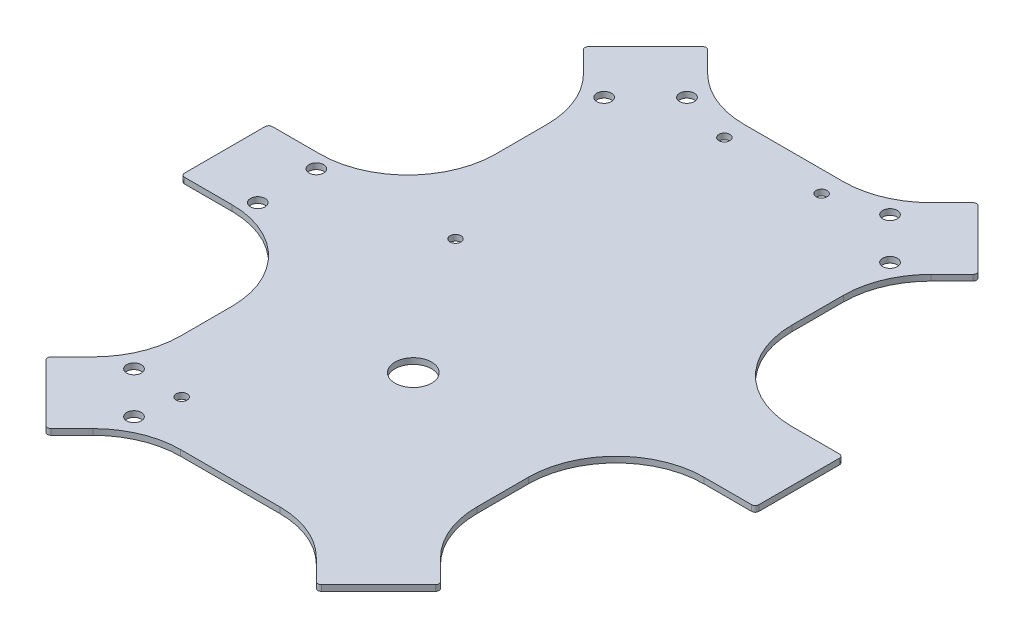
from build123d import *

# Parameters (mm, degrees)
SKETCH_8_R      = 2
SKETCH_8_R_2    = 5
SKETCH_8_R_3    = 1.5
EXTRUDE_1_DEPTH = 1.6


with BuildPart() as part:
    # 草图8 → 凸台-拉伸1 (new body)
    with BuildSketch(Plane.XZ):
        with BuildLine():
            Line((30.529437252, 84), (36.227922061, 89.69848481))
            ThreePointArc((36.227922061, 89.69848481), (36.935028843, 89.991378029), (37.642135624, 89.69848481))
            Line((37.642135624, 89.69848481), (53.19848481, 74.142135624))
            ThreePointArc((53.19848481, 74.142135624), (53.491378029, 73.435028843), (53.19848481, 72.727922061))
            Line((53.19848481, 72.727922061), (47.5, 67.029437252))
            ThreePointArc((47.5, 67.029437252), (42.297453968, 59.24327688), (40.470562748, 50.058874503))
            Line((40.470562748, 50.058874503), (40.470562748, 36))
            ThreePointArc((40.470562748, 36), (47.5, 19.029437252), (64.470562748, 12))
            Line((64.470562748, 12), (77.470562748, 12))
            ThreePointArc((77.470562748, 12), (78.17766953, 11.707106781), (78.470562748, 11))
            Line((78.470562748, 11), (78.470562748, -11))
            ThreePointArc((78.470562748, -11), (78.17766953, -11.707106781), (77.470562748, -12))
            Line((77.470562748, -12), (64.470562748, -12))
            ThreePointArc((64.470562748, -12), (47.5, -19.029437252), (40.470562748, -36))
            Line((40.470562748, -36), (40.470562748, -50.058874503))
            ThreePointArc((40.470562748, -50.058874503), (42.297453968, -59.24327688), (47.5, -67.029437252))
            Line((47.5, -67.029437252), (53.19848481, -72.727922061))
            ThreePointArc((53.19848481, -72.727922061), (53.491378029, -73.435028843), (53.19848481, -74.142135624))
            Line((53.19848481, -74.142135624), (37.642135624, -89.69848481))
            ThreePointArc((37.642135624, -89.69848481), (36.935028843, -89.991378029), (36.227922061, -89.69848481))
            Line((36.227922061, -89.69848481), (30.529437252, -84))
            ThreePointArc((30.529437252, -84), (22.74327688, -78.797453968), (13.558874503, -76.970562748))
            Line((13.558874503, -76.970562748), (-13.558874503, -76.970562748))
            ThreePointArc((-13.558874503, -76.970562748), (-22.74327688, -78.797453968), (-30.529437252, -84))
            Line((-30.529437252, -84), (-36.227922061, -89.69848481))
            ThreePointArc((-36.227922061, -89.69848481), (-36.935028843, -89.991378029), (-37.642135624, -89.69848481))
            Line((-37.642135624, -89.69848481), (-53.19848481, -74.142135624))
            ThreePointArc((-53.19848481, -74.142135624), (-53.491378029, -73.435028843), (-53.19848481, -72.727922061))
            Line((-53.19848481, -72.727922061), (-47.5, -67.029437252))
            ThreePointArc((-47.5, -67.029437252), (-42.297453968, -59.24327688), (-40.470562748, -50.058874503))
            Line((-40.470562748, -50.058874503), (-40.470562748, -36))
            ThreePointArc((-40.470562748, -36), (-47.5, -19.029437252), (-64.470562748, -12))
            Line((-64.470562748, -12), (-77.470562748, -12))
            ThreePointArc((-77.470562748, -12), (-78.17766953, -11.707106781), (-78.470562748, -11))
            Line((-78.470562748, -11), (-78.470562748, 11))
            ThreePointArc((-78.470562748, 11), (-78.17766953, 11.707106781), (-77.470562748, 12))
            Line((-77.470562748, 12), (-64.470562748, 12))
            ThreePointArc((-64.470562748, 12), (-47.5, 19.029437252), (-40.470562748, 36))
            Line((-40.470562748, 36), (-40.470562748, 50.058874503))
            ThreePointArc((-40.470562748, 50.058874503), (-42.297453968, 59.24327688), (-47.5, 67.029437252))
            Line((-47.5, 67.029437252), (-53.19848481, 72.727922061))
            ThreePointArc((-53.19848481, 72.727922061), (-53.491378029, 73.435028843), (-53.19848481, 74.142135624))
            Line((-53.19848481, 74.142135624), (-37.642135624, 89.69848481))
            ThreePointArc((-37.642135624, 89.69848481), (-36.935028843, 89.991378029), (-36.227922061, 89.69848481))
            Line((-36.227922061, 89.69848481), (-30.529437252, 84))
            ThreePointArc((-30.529437252, 84), (-22.74327688, 78.797453968), (-13.558874503, 76.970562748))
            Line((-13.558874503, 76.970562748), (13.558874503, 76.970562748))
            ThreePointArc((13.558874503, 76.970562748), (22.74327688, 78.797453968), (30.529437252, 84))
        make_face()
        with Locations(Location((-39.056349186, 64.242640687, 0), (0, 0, 90))):
            Circle(SKETCH_8_R, mode=Mode.SUBTRACT)
        with Locations(Location((-27.742640687, 75.556349186, 0), (0, 0, 90))):
            Circle(SKETCH_8_R, mode=Mode.SUBTRACT)
        with Locations(Location((0, 26.970562748, 0), (0, 0, 90))):
            Circle(SKETCH_8_R_2, mode=Mode.SUBTRACT)
        with Locations(Location((-61.470562748, 8, 0), (0, 0, 90))):
            Circle(SKETCH_8_R, mode=Mode.SUBTRACT)
        with Locations(Location((-25.887975085, -10.446849588, 0), (0, 0, 90))):
            Circle(SKETCH_8_R_3, mode=Mode.SUBTRACT)
        with Locations(Location((-25.887975085, 64.387975085, 0), (0, 0, 90))):
            Circle(SKETCH_8_R_3, mode=Mode.SUBTRACT)
        with Locations(Location((27.742640687, -75.556349186, 0), (0, 0, 90))):
            Circle(SKETCH_8_R, mode=Mode.SUBTRACT)
        with Locations(Location((39.056349186, -64.242640687, 0), (0, 0, 90))):
            Circle(SKETCH_8_R, mode=Mode.SUBTRACT)
        with Locations(Location((-27.742640687, -75.556349186, 0), (0, 0, 90))):
            Circle(SKETCH_8_R, mode=Mode.SUBTRACT)
        with Locations(Location((-39.056349186, -64.242640687, 0), (0, 0, 90))):
            Circle(SKETCH_8_R, mode=Mode.SUBTRACT)
        with Locations(Location((13.427835179, -71.170562748, 0), (0, 0, 90))):
            Circle(SKETCH_8_R_3, mode=Mode.SUBTRACT)
        with Locations(Location((-13.1297961, -71.170562748, 0), (0, 0, 90))):
            Circle(SKETCH_8_R_3, mode=Mode.SUBTRACT)
        with Locations(Location((-61.470562748, -8, 0), (0, 0, 90))):
            Circle(SKETCH_8_R, mode=Mode.SUBTRACT)
    extrude(amount=EXTRUDE_1_DEPTH)


solid = part.part
